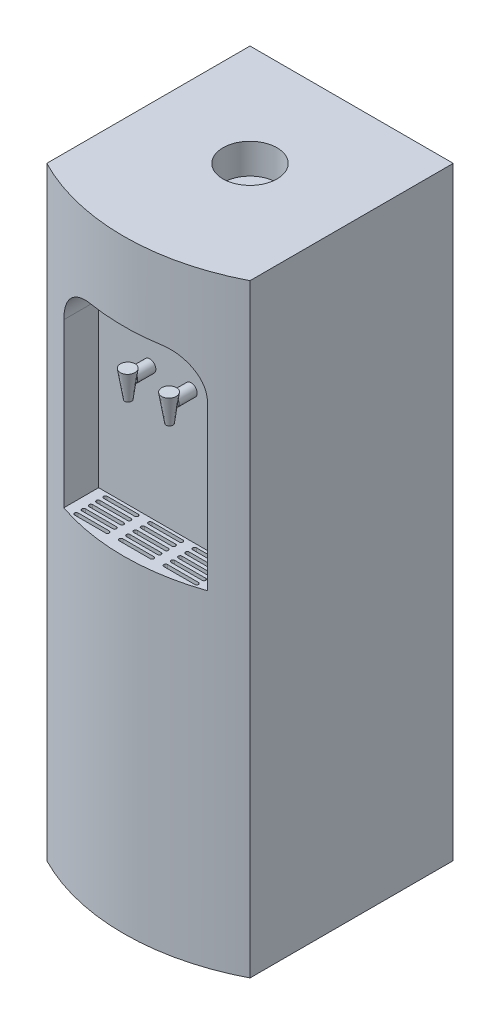
from build123d import *

# Parameters (mm, degrees)
BOSS_EXTRUDE1_DEPTH = 127
CUT_EXTRUDE1_DEPTH  = 88.9
CUT_EXTRUDE2_DEPTH  = 1.27
CUT_EXTRUDE3_DEPTH  = 6.35
SKETCH6_R           = 1.27
BOSS_EXTRUDE2_DEPTH = 3.81


with BuildPart() as part:
    # Sketch1 → Boss-Extrude1 (new body)
    with BuildSketch(Plane(origin=(0, 0, 0), x_dir=(1, 0, 0), z_dir=(0, 1, 0))):
        with BuildLine():
            Line((0, 0), (42.739614803, 0))
            Line((42.739614803, 0), (42.739614803, -42.739614803))
            ThreePointArc((42.739614803, -42.739614803), (21.369807402, -47.941054373), (0, -42.739614803))
            Line((0, -42.739614803), (0, 0))
        make_face()
    extrude(amount=BOSS_EXTRUDE1_DEPTH)

    # Sketch2 → Cut-Extrude1 (cut)
    with BuildSketch(Plane.XY.offset(127)):
        with BuildLine():
            Line((13.881687598, 110.608783011), (28.857927206, 110.608783011))
            ThreePointArc((28.857927206, 110.608783011), (34.246080878, 108.376936683), (36.477927206, 102.988783011))
            Line((36.477927206, 102.988783011), (36.477927206, 68.734309223))
            Line((36.477927206, 68.734309223), (6.261687598, 68.734309223))
            Line((6.261687598, 68.734309223), (6.261687598, 102.988783011))
            ThreePointArc((6.261687598, 102.988783011), (8.493533925, 108.376936683), (13.881687598, 110.608783011))
        make_face()
    extrude(amount=-CUT_EXTRUDE1_DEPTH, mode=Mode.SUBTRACT)

    # Sketch4 → Cut-Extrude2 (cut)
    with BuildSketch(Plane(origin=(0, 68.734309223, 0), x_dir=(1, 0, 0), z_dir=(0, 1, 0))):
        with BuildLine():
            Line((18.101107041, -45.607119247), (24.638507762, -45.607119247))
            ThreePointArc((24.638507762, -45.607119247), (25.019507762, -45.226119247), (24.638507762, -44.845119247))
            Line((24.638507762, -44.845119247), (18.101107041, -44.845119247))
            ThreePointArc((18.101107041, -44.845119247), (17.720107041, -45.226119247), (18.101107041, -45.607119247))
        make_face()
        with BuildLine():
            Line((8.722196959, -45.607119247), (15.25959768, -45.607119247))
            ThreePointArc((15.25959768, -45.607119247), (15.64059768, -45.226119247), (15.25959768, -44.845119247))
            Line((15.25959768, -44.845119247), (8.722196959, -44.845119247))
            ThreePointArc((8.722196959, -44.845119247), (8.341196959, -45.226119247), (8.722196959, -45.607119247))
        make_face()
        with BuildLine():
            Line((8.722196959, -42.559119247), (15.25959768, -42.559119247))
            ThreePointArc((15.25959768, -42.559119247), (15.64059768, -42.178119247), (15.25959768, -41.797119247))
            Line((15.25959768, -41.797119247), (8.722196959, -41.797119247))
            ThreePointArc((8.722196959, -41.797119247), (8.341196959, -42.178119247), (8.722196959, -42.559119247))
        make_face()
        with BuildLine():
            Line((8.722196959, -44.083119247), (15.25959768, -44.083119247))
            ThreePointArc((15.25959768, -44.083119247), (15.64059768, -43.702119247), (15.25959768, -43.321119247))
            Line((15.25959768, -43.321119247), (8.722196959, -43.321119247))
            ThreePointArc((8.722196959, -43.321119247), (8.341196959, -43.702119247), (8.722196959, -44.083119247))
        make_face()
        with BuildLine():
            Line((18.101107041, -44.083119247), (24.638507762, -44.083119247))
            ThreePointArc((24.638507762, -44.083119247), (25.019507762, -43.702119247), (24.638507762, -43.321119247))
            Line((24.638507762, -43.321119247), (18.101107041, -43.321119247))
            ThreePointArc((18.101107041, -43.321119247), (17.720107041, -43.702119247), (18.101107041, -44.083119247))
        make_face()
        with BuildLine():
            Line((18.101107041, -42.559119247), (24.638507762, -42.559119247))
            ThreePointArc((24.638507762, -42.559119247), (25.019507762, -42.178119247), (24.638507762, -41.797119247))
            Line((24.638507762, -41.797119247), (18.101107041, -41.797119247))
            ThreePointArc((18.101107041, -41.797119247), (17.720107041, -42.178119247), (18.101107041, -42.559119247))
        make_face()
        with BuildLine():
            Line((18.101107041, -41.035119247), (24.638507762, -41.035119247))
            ThreePointArc((24.638507762, -41.035119247), (25.019507762, -40.654119247), (24.638507762, -40.273119247))
            Line((24.638507762, -40.273119247), (18.101107041, -40.273119247))
            ThreePointArc((18.101107041, -40.273119247), (17.720107041, -40.654119247), (18.101107041, -41.035119247))
        make_face()
        with BuildLine():
            Line((18.101107041, -39.511119247), (24.638507762, -39.511119247))
            ThreePointArc((24.638507762, -39.511119247), (25.019507762, -39.130119247), (24.638507762, -38.749119247))
            Line((24.638507762, -38.749119247), (18.101107041, -38.749119247))
            ThreePointArc((18.101107041, -38.749119247), (17.720107041, -39.130119247), (18.101107041, -39.511119247))
        make_face()
        with BuildLine():
            Line((8.722196959, -41.035119247), (15.25959768, -41.035119247))
            ThreePointArc((15.25959768, -41.035119247), (15.64059768, -40.654119247), (15.25959768, -40.273119247))
            Line((15.25959768, -40.273119247), (8.722196959, -40.273119247))
            ThreePointArc((8.722196959, -40.273119247), (8.341196959, -40.654119247), (8.722196959, -41.035119247))
        make_face()
        with BuildLine():
            Line((8.722196959, -39.511119247), (15.25959768, -39.511119247))
            ThreePointArc((15.25959768, -39.511119247), (15.64059768, -39.130119247), (15.25959768, -38.749119247))
            Line((15.25959768, -38.749119247), (8.722196959, -38.749119247))
            ThreePointArc((8.722196959, -38.749119247), (8.341196959, -39.130119247), (8.722196959, -39.511119247))
        make_face()
        with BuildLine():
            Line((27.480017123, -44.083119247), (34.017417844, -44.083119247))
            ThreePointArc((34.017417844, -44.083119247), (34.398417844, -43.702119247), (34.017417844, -43.321119247))
            Line((34.017417844, -43.321119247), (27.480017123, -43.321119247))
            ThreePointArc((27.480017123, -43.321119247), (27.099017123, -43.702119247), (27.480017123, -44.083119247))
        make_face()
        with BuildLine():
            Line((27.480017123, -42.559119247), (34.017417844, -42.559119247))
            ThreePointArc((34.017417844, -42.559119247), (34.398417844, -42.178119247), (34.017417844, -41.797119247))
            Line((34.017417844, -41.797119247), (27.480017123, -41.797119247))
            ThreePointArc((27.480017123, -41.797119247), (27.099017123, -42.178119247), (27.480017123, -42.559119247))
        make_face()
        with BuildLine():
            Line((27.480017123, -41.035119247), (34.017417844, -41.035119247))
            ThreePointArc((34.017417844, -41.035119247), (34.398417844, -40.654119247), (34.017417844, -40.273119247))
            Line((34.017417844, -40.273119247), (27.480017123, -40.273119247))
            ThreePointArc((27.480017123, -40.273119247), (27.099017123, -40.654119247), (27.480017123, -41.035119247))
        make_face()
        with BuildLine():
            Line((27.480017123, -39.511119247), (34.017417844, -39.511119247))
            ThreePointArc((34.017417844, -39.511119247), (34.398417844, -39.130119247), (34.017417844, -38.749119247))
            Line((34.017417844, -38.749119247), (27.480017123, -38.749119247))
            ThreePointArc((27.480017123, -38.749119247), (27.099017123, -39.130119247), (27.480017123, -39.511119247))
        make_face()
        with BuildLine():
            ThreePointArc((27.480017123, -44.845119247), (27.099017123, -45.226119247), (27.480017123, -45.607119247))
            Line((27.480017123, -45.607119247), (34.017417844, -45.607119247))
            ThreePointArc((34.017417844, -45.607119247), (34.398417844, -45.226119247), (34.017417844, -44.845119247))
            Line((34.017417844, -44.845119247), (27.480017123, -44.845119247))
        make_face()
    extrude(amount=-CUT_EXTRUDE2_DEPTH, mode=Mode.SUBTRACT)

    # Sketch5 → Cut-Extrude3 (cut)
    with BuildSketch(Plane(origin=(0, 127, 0), x_dir=(1, 0, 0), z_dir=(0, 1, 0))):
        with BuildLine():
            ThreePointArc((27.058825704, -21.369807402), (21.369807402, -15.680789099), (15.680789099, -21.369807402))
            Line((15.680789099, -21.369807402), (27.058825704, -21.369807402))
        make_face()
        with BuildLine():
            Line((27.058825704, -21.369807402), (15.680789099, -21.369807402))
            ThreePointArc((15.680789099, -21.369807402), (21.369807402, -27.058825704), (27.058825704, -21.369807402))
        make_face()
    extrude(amount=-CUT_EXTRUDE3_DEPTH, mode=Mode.SUBTRACT)

    # Sketch6 → Boss-Extrude2 (add)
    with BuildSketch(Plane.XY.offset(38.1)):
        with Locations(Location((17.026937254, 96.316061715, 0), (0, 0, 180))):
            Circle(SKETCH6_R)
        with Locations(Location((25.712677549, 96.316061715, 0), (0, 0, 180))):
            Circle(SKETCH6_R)
    extrude(amount=BOSS_EXTRUDE2_DEPTH)

    # Sketch8 → Revolve1 (revolve)
    with BuildSketch(Plane.YZ.offset(17.026937254), mode=Mode.PRIVATE) as revolve1_sk:
        Polygon((92.462776609, 42.625909045), (92.462776609, 43.341818089), (98.173073883, 44.293534302), (98.173073883, 42.739614803), align=None)
    revolve1 = revolve(revolve1_sk.sketch.rotate(Axis((17.026937254, 92.462776609, 42.625909045), (0, 0.9998018069764348, 0.01990845967561906)), 180), axis=Axis((17.026937254, 92.462776609, 42.625909045), (0, 0.9998018069764348, 0.01990845967561906)))

    # Mirror1: Revolve1 across plane
    add(revolve1.mirror(Plane.ZY.offset(-21.369807402)))


solid = part.part
